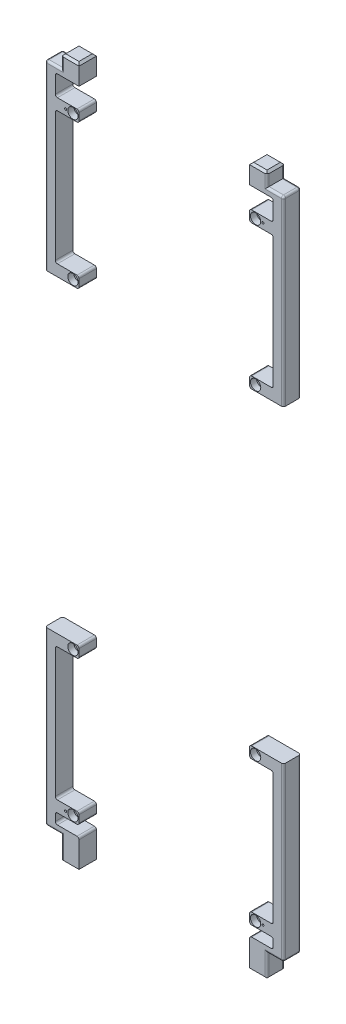
from build123d import *

# Parameters (mm, degrees)
FRAME_ALL_DEPTH                          = 2.6
F_1_5U_2U_3U_CUTOUT_DEPTH                = 2.6
SKETCH1_9_W                              = 41.5
SKETCH1_9_H                              = 5
BOTTOM_CROSS_PIECE_ALL_DEPTH             = 2.6
SKETCH1_6_W                              = 41.5
SKETCH1_6_H                              = 5
SKETCH1_6_H_2                            = 3
CROSS_PIECES_ALL_DEPTH                   = 3
SKETCH1_7_W                              = 8.5
SKETCH1_7_H                              = 14.5
FRAME_THICKEN_ALL_DEPTH                  = 8.5
SKETCH1_12_W                             = 11.5
SKETCH1_12_H                             = 1.6
F_1_5U_2U_3U_CUTOUT_THICKEN_DEPTH        = 8.5
SKETCH1_13_W                             = 11.5
SKETCH1_13_H                             = 5.5
F_2U_3U_TABS_DEPTH                       = 8.5
SKETCH1_14_W                             = 11.5
SKETCH1_14_H                             = 5.5
F_3U_TABS_DEPTH                          = 8.5
F_2U_3U_X_SCREW_PILLARS_AT_2_COUNT       = 2
F_2U_3U_X_SCREW_PILLARS_AT_2_PITCH       = 225.9
F_2U_3U_X_SCREW_PILLARS_AT_3_COUNT       = 2
F_2U_3U_X_SCREW_PILLARS_AT_3_PITCH       = 70
F_3U_X_SCREW_PILLARS_AT_2_COUNT          = 2
F_3U_X_SCREW_PILLARS_AT_2_PITCH          = 48.4
Y_HOLE_ALL_D                             = 1.5
END_CHAMFER_ALL_SIZE                     = 1
FILLET1_ALL_R                            = 2
FILLET2_ALL_R                            = 2
F_1_5U_2U_3U_SPINE_FILLET_R              = 1
F_2U_3U_TAB_FILLET_R                     = 1
F_3U_TAB_FILLET_R                        = 1
END_CHAMFER_ALL_OF_3U_MIRROR_SIZE        = 1
FILLET1_ALL_OF_3U_MIRROR_R               = 2
FILLET2_ALL_OF_3U_MIRROR_R               = 2
F_1_5U_2U_3U_SPINE_FILLET_OF_3U_MIRROR_R = 1
F_2U_3U_TAB_FILLET_OF_3U_MIRROR_R        = 1
F_3U_TAB_FILLET_OF_3U_MIRROR_R           = 1
F_3U_BAR_REMOVE_DEPTH                    = 337.150635876
F_3U_BAR_REMOVE_DEPTH_BACK               = 337.150635876
SKETCH32_W                               = 83
SKETCH32_H                               = 5.6
F_3U_SPLIT_DEPTH                         = 125
F_3U_SPLIT_DEPTH_BACK                    = 10
SKETCH27_W                               = 8.5
SKETCH27_H                               = 150.4


with BuildPart() as part:
    # Sketch1 → Frame(All) (new body)
    with BuildSketch(Plane.XY):
        Polygon((41.5, 322.5), (0, 322.5), (0, 319.5), (53, 319.5), (53, 309.45), (41.5, 309.45), (41.5, 303.95), (53, 303.95), (53, 11.95), (41.5, 11.95), (41.5, 8.05), (50, 8.05), (50, 8.95), (58, 8.95), (58, 322.5), (50, 322.5), (50, 329), (41.5, 329), align=None)
    frame_all = extrude(amount=-FRAME_ALL_DEPTH)

    # Sketch1<8> → 1.5U/2U/3U Cutout (add)
    with BuildSketch(Plane.XY):
        Polygon((58, 0), (58, 8.95), (50, 8.95), (50, 8.05), (53, 8.05), (53, 3), (50, 3), (50, 0), align=None)
    f_1_5u_2u_3u_cutout = extrude(amount=-F_1_5U_2U_3U_CUTOUT_DEPTH)

    # Sketch1<9> → Bottom Cross Piece (All) (add)
    with BuildSketch(Plane.XY):
        with Locations((20.75, -2.5)):
            Rectangle(SKETCH1_9_W, SKETCH1_9_H)
        Polygon((50, -11.5), (50, 0), (50, 3), (41.5, 3), (41.5, 0), (41.5, -5), (41.5, -11.5), align=None)
    bottom_cross_piece_all = extrude(amount=-BOTTOM_CROSS_PIECE_ALL_DEPTH)

    # Sketch1<6> → Cross Pieces (All) (add)
    with BuildSketch(Plane.XY):
        with Locations((20.75, -2.5)):
            Rectangle(SKETCH1_6_W, SKETCH1_6_H)
        with Locations((20.75, 321)):
            Rectangle(SKETCH1_6_W, SKETCH1_6_H_2)
    cross_pieces_all = extrude(amount=CROSS_PIECES_ALL_DEPTH)

    # Sketch1<7> → Frame Thicken (All) (add)
    with BuildSketch(Plane.XY):
        Polygon((41.5, 329), (41.5, 319.5), (53, 319.5), (53, 309.45), (41.5, 309.45), (41.5, 303.95), (53, 303.95), (53, 11.95), (41.5, 11.95), (41.5, 8.05), (50, 8.05), (50, 8.95), (58, 8.95), (58, 322.5), (50, 322.5), (50, 329), align=None)
        with Locations((45.75, -4.25)):
            Rectangle(SKETCH1_7_W, SKETCH1_7_H)
    frame_thicken_all = extrude(amount=-FRAME_THICKEN_ALL_DEPTH)

    # Sketch1<12> → 1.5U/2U/3U Cutout Thicken (add)
    with BuildSketch(Plane.XY):
        with Locations((47.25, 12.75)):
            Rectangle(SKETCH1_12_W, SKETCH1_12_H)
        Polygon((58, 0), (58, 8.95), (50, 8.95), (50, 8.05), (53, 8.05), (53, 3), (50, 3), (50, 0), align=None)
    f_1_5u_2u_3u_cutout_thicken = extrude(amount=-F_1_5U_2U_3U_CUTOUT_THICKEN_DEPTH)

    # Sketch1<13> → 2U/3U tabs (add)
    with BuildSketch(Plane.XY):
        with Locations((47.25, 236.7)):
            Rectangle(SKETCH1_13_W, SKETCH1_13_H)
        with Locations((47.25, 80.8)):
            Rectangle(SKETCH1_13_W, SKETCH1_13_H)
    f_2u_3u_tabs = extrude(amount=-F_2U_3U_TABS_DEPTH)

    # Sketch1<14> → 3U tabs (add)
    with BuildSketch(Plane.XY):
        with Locations((47.25, 182.95)):
            Rectangle(SKETCH1_14_W, SKETCH1_14_H)
        with Locations((47.25, 134.55)):
            Rectangle(SKETCH1_14_W, SKETCH1_14_H)
    f_3u_tabs = extrude(amount=-F_3U_TABS_DEPTH)

    # Sketch2 → X Top Screw Pillar (All) (revolve, cut)
    with BuildSketch(Plane(origin=(44.45, 306.7, 0), x_dir=(0, -1, 0), z_dir=(1, 0, 0))):
        Polygon((0, 0), (0, 10.871247898), (1.45, 10), (1.45, 3), (2.5, 3), (2.5, 0), align=None)
    x_top_screw_pillar_all = revolve(axis=Axis((44.45, 306.7, 6.35), (0, 0, -1)), mode=Mode.SUBTRACT)

    # Sketch6 → X Top Dowel Hole (All) (revolve, cut)
    with BuildSketch(Plane(origin=(48, 306.7, -8.5), x_dir=(0, 1, 0), z_dir=(1, 0, 0))):
        Polygon((0, 0), (0, 3.450645464), (0.75, 3), (0.75, 0), align=None)
    x_top_dowel_hole_all = revolve(axis=Axis((48, 306.7, -14.85), (0, 0, 1)), mode=Mode.SUBTRACT)

    # Sketch10 → X Top Dowel Hole Small (All) (revolve, cut)
    with BuildSketch(Plane(origin=(48, 306.7, -8.5), x_dir=(0, 1, 0), z_dir=(1, 0, 0))):
        Polygon((0, 0), (0, 8.80043031), (0.5, 8.5), (0.5, 0), align=None)
    x_top_dowel_hole_small_all = revolve(axis=Axis((48, 306.7, -14.85), (0, 0, 1)), mode=Mode.SUBTRACT)

    # Sketch13 → 2U/3U X Screw Pillars (revolve, cut)
    with BuildSketch(Plane(origin=(44.45, 10.8, 0), x_dir=(0, -1, 0), z_dir=(1, 0, 0))):
        Polygon((0, 0), (0, 9.401290929), (1.5, 8.5), (1.5, 2.9), (2.5, 2.9), (2.5, 0), align=None)
    f_2u_3u_x_screw_pillars = revolve(axis=Axis((44.45, 10.8, 6.35), (0, 0, -1)), mode=Mode.SUBTRACT)

    # 2U/3U X Screw Pillars at 2: 2U/3U X Screw Pillars ×2
    with Locations(*[(0, i * F_2U_3U_X_SCREW_PILLARS_AT_2_PITCH, 0) for i in range(1, F_2U_3U_X_SCREW_PILLARS_AT_2_COUNT)]):
        add(f_2u_3u_x_screw_pillars, mode=Mode.SUBTRACT)

    # 2U/3U X Screw Pillars at 3: 2U/3U X Screw Pillars ×2
    with Locations(*[(0, i * F_2U_3U_X_SCREW_PILLARS_AT_3_PITCH, 0) for i in range(1, F_2U_3U_X_SCREW_PILLARS_AT_3_COUNT)]):
        add(f_2u_3u_x_screw_pillars, mode=Mode.SUBTRACT)

    # Sketch14 → 3U X Screw Pillars (revolve, cut)
    with BuildSketch(Plane(origin=(44.45, 134.55, 0), x_dir=(0, -1, 0), z_dir=(1, 0, 0))):
        Polygon((0, 0), (0, 9.401290929), (1.5, 8.5), (1.5, 2.9), (2.5, 2.9), (2.5, 0), align=None)
    f_3u_x_screw_pillars = revolve(axis=Axis((44.45, 134.55, 6.35), (0, 0, -1)), mode=Mode.SUBTRACT)

    # 3U X Screw Pillars at 2: 3U X Screw Pillars ×2
    with Locations(*[(0, i * F_3U_X_SCREW_PILLARS_AT_2_PITCH, 0) for i in range(1, F_3U_X_SCREW_PILLARS_AT_2_COUNT)]):
        add(f_3u_x_screw_pillars, mode=Mode.SUBTRACT)

    # Sketch15 → 1.5U/2U/3U Dowel Hole (revolve, cut)
    with BuildSketch(Plane(origin=(48, 10.8, -8.5), x_dir=(0, 1, 0), z_dir=(1, 0, 0))):
        Polygon((0, 0), (0, 3.450645464), (0.75, 3), (0.75, 0), align=None)
    f_1_5u_2u_3u_dowel_hole = revolve(axis=Axis((48, 10.8, -14.85), (0, 0, 1)), mode=Mode.SUBTRACT)

    # Sketch16 → 1.5U/2U/3U Dowel Hole Small (revolve, cut)
    with BuildSketch(Plane(origin=(48, 10.8, -8.5), x_dir=(0, 1, 0), z_dir=(1, 0, 0))):
        Polygon((0, 0), (0, 8.80043031), (0.5, 8.5), (0.5, 0), align=None)
    f_1_5u_2u_3u_dowel_hole_small = revolve(axis=Axis((48, 10.8, -14.85), (0, 0, 1)), mode=Mode.SUBTRACT)

    # Y Hole (All) (through all)
    with Locations(Plane(origin=(27.5, -5, -0.5), x_dir=(-1, 0, 0), z_dir=(0, -1, 0))):
        with Locations((0, 0)):
            y_hole_all = Hole(Y_HOLE_ALL_D / 2)

    # End Chamfer (All)
    end_chamfer_all_edges = [part.edges().sort_by_distance(p)[0] for p in [
        (45.75, 329, -8.5),
        (45.75, -11.5, -8.5),
        (45.75, 329, 0),
        (41.5, 329, -4.25),
        (50, 329, -4.25),
        (45.75, -11.5, 0),
        (50, -11.5, -4.25),
        (41.5, -11.5, -4.25),
    ]]
    chamfer(end_chamfer_all_edges, length=END_CHAMFER_ALL_SIZE)

    # Fillet1 (All)
    fillet1_all_edges = [part.edges().sort_by_distance(p)[0] for p in [
        (41.5, -5, 1.5),
        (41.5, 322.5, 1.5),
    ]]
    fillet(fillet1_all_edges, radius=FILLET1_ALL_R)

    # Fillet2 (All)
    fillet2_all_edges = [part.edges().sort_by_distance(p)[0] for p in [
        (41.5, -5, -1.3),
        (41.5, 322.5, -1.3),
    ]]
    fillet(fillet2_all_edges, radius=FILLET2_ALL_R)

    # 1.5U/2U/3U Spine Fillet
    f_1_5u_2u_3u_spine_fillet_edges = [part.edges().sort_by_distance(p)[0] for p in [
        (54, 322.5, -8.5),
        (58, 161.25, -8.5),
        (50, -5.25, -8.5),
        (54, 0, -8.5),
        (54, 322.5, 0),
        (58, 161.25, 0),
        (58, 322.5, -4.25),
        (50, 325.25, -8.5),
        (50, 325.25, 0),
        (54, 0, 0),
        (58, 0, -4.25),
        (50, -5.25, 0),
    ]]
    fillet(f_1_5u_2u_3u_spine_fillet_edges, radius=F_1_5U_2U_3U_SPINE_FILLET_R)

    # 2U/3U Tab Fillet
    f_2u_3u_tab_fillet_edges = [part.edges().sort_by_distance(p)[0] for p in [
        (53, 13.55, -4.25),
        (41.5, 13.55, -4.25),
        (41.5, 233.95, -4.25),
        (41.5, 239.45, -4.25),
        (53, 239.45, -4.25),
        (41.5, 78.05, -4.25),
        (41.5, 83.55, -4.25),
        (53, 78.05, -4.25),
        (41.5, 303.95, -4.25),
        (41.5, 309.45, -4.25),
        (53, 309.45, -4.25),
        (53, 319.5, -4.25),
        (41.5, 8.05, -4.25),
        (53, 303.95, -4.25),
        (53, 3, -4.25),
        (53, 8.05, -4.25),
        (41.5, 3, -4.25),
    ]]
    fillet(f_2u_3u_tab_fillet_edges, radius=F_2U_3U_TAB_FILLET_R)

    # 3U Tab Fillet
    f_3u_tab_fillet_edges = [part.edges().sort_by_distance(p)[0] for p in [
        (41.5, 180.2, -4.25),
        (41.5, 185.7, -4.25),
        (53, 185.7, -4.25),
        (53, 180.2, -4.25),
        (41.5, 131.8, -4.25),
        (41.5, 137.3, -4.25),
        (53, 137.3, -4.25),
        (53, 131.8, -4.25),
    ]]
    fillet(f_3u_tab_fillet_edges, radius=F_3U_TAB_FILLET_R)

    # 3U Mirror: Frame(All), 1.5U/2U/3U Cutout, Bottom Cross Piece (All), Cross Pieces (All), Frame Thicken (All), 1.5U/2U/3U Cutout Thicken, 2U/3U tabs, 3U tabs, X Top Screw Pillar (All), X Top Dowel Hole (All), X Top Dowel Hole Small (All), 2U/3U X Screw Pillars, 3U X Screw Pillars, 1.5U/2U/3U Dowel Hole, 1.5U/2U/3U Dowel Hole Small, Y Hole (All) across plane
    add(frame_all.mirror(Plane(origin=(0, 0, -2.6), x_dir=(0, 0, 1), z_dir=(1, 0, 0))))
    add(f_1_5u_2u_3u_cutout.mirror(Plane(origin=(0, 0, -2.6), x_dir=(0, 0, 1), z_dir=(1, 0, 0))))
    add(bottom_cross_piece_all.mirror(Plane(origin=(0, 0, -2.6), x_dir=(0, 0, 1), z_dir=(1, 0, 0))))
    add(cross_pieces_all.mirror(Plane(origin=(0, 0, -2.6), x_dir=(0, 0, 1), z_dir=(1, 0, 0))))
    add(frame_thicken_all.mirror(Plane(origin=(0, 0, -2.6), x_dir=(0, 0, 1), z_dir=(1, 0, 0))))
    add(f_1_5u_2u_3u_cutout_thicken.mirror(Plane(origin=(0, 0, -2.6), x_dir=(0, 0, 1), z_dir=(1, 0, 0))))
    add(f_2u_3u_tabs.mirror(Plane(origin=(0, 0, -2.6), x_dir=(0, 0, 1), z_dir=(1, 0, 0))))
    add(f_3u_tabs.mirror(Plane(origin=(0, 0, -2.6), x_dir=(0, 0, 1), z_dir=(1, 0, 0))))
    add(x_top_screw_pillar_all.mirror(Plane(origin=(0, 0, -2.6), x_dir=(0, 0, 1), z_dir=(1, 0, 0))), mode=Mode.SUBTRACT)
    add(x_top_dowel_hole_all.mirror(Plane(origin=(0, 0, -2.6), x_dir=(0, 0, 1), z_dir=(1, 0, 0))), mode=Mode.SUBTRACT)
    add(x_top_dowel_hole_small_all.mirror(Plane(origin=(0, 0, -2.6), x_dir=(0, 0, 1), z_dir=(1, 0, 0))), mode=Mode.SUBTRACT)
    add(f_2u_3u_x_screw_pillars.mirror(Plane(origin=(0, 0, -2.6), x_dir=(0, 0, 1), z_dir=(1, 0, 0))), mode=Mode.SUBTRACT)
    add(f_3u_x_screw_pillars.mirror(Plane(origin=(0, 0, -2.6), x_dir=(0, 0, 1), z_dir=(1, 0, 0))), mode=Mode.SUBTRACT)
    add(f_1_5u_2u_3u_dowel_hole.mirror(Plane(origin=(0, 0, -2.6), x_dir=(0, 0, 1), z_dir=(1, 0, 0))), mode=Mode.SUBTRACT)
    add(f_1_5u_2u_3u_dowel_hole_small.mirror(Plane(origin=(0, 0, -2.6), x_dir=(0, 0, 1), z_dir=(1, 0, 0))), mode=Mode.SUBTRACT)
    add(y_hole_all.mirror(Plane(origin=(0, 0, -2.6), x_dir=(0, 0, 1), z_dir=(1, 0, 0))), mode=Mode.SUBTRACT)

    # 3U Mirror copy 1 sketch → 3U Mirror copy 1 (revolve, cut)
    with BuildSketch(Plane(origin=(-44.45, 236.7, 0), x_dir=(0, -1, 0), z_dir=(-1, 0, 0))):
        Polygon((0, 0), (0, -9.401290929), (1.5, -8.5), (1.5, -2.9), (2.5, -2.9), (2.5, 0), align=None)
    revolve(axis=Axis((-44.45, 236.7, 6.35), (0, 0, 1)), mode=Mode.SUBTRACT)

    # 3U Mirror copy 2 sketch → 3U Mirror copy 2 (revolve, cut)
    with BuildSketch(Plane(origin=(-44.45, 80.8, 0), x_dir=(0, -1, 0), z_dir=(-1, 0, 0))):
        Polygon((0, 0), (0, -9.401290929), (1.5, -8.5), (1.5, -2.9), (2.5, -2.9), (2.5, 0), align=None)
    revolve(axis=Axis((-44.45, 80.8, 6.35), (0, 0, 1)), mode=Mode.SUBTRACT)

    # 3U Mirror copy 3 sketch → 3U Mirror copy 3 (revolve, cut)
    with BuildSketch(Plane(origin=(-44.45, 182.95, 0), x_dir=(0, -1, 0), z_dir=(-1, 0, 0))):
        Polygon((0, 0), (0, -9.401290929), (1.5, -8.5), (1.5, -2.9), (2.5, -2.9), (2.5, 0), align=None)
    revolve(axis=Axis((-44.45, 182.95, 6.35), (0, 0, 1)), mode=Mode.SUBTRACT)

    # End Chamfer (All) of 3U Mirror
    end_chamfer_all_of_3u_mirror_edges = [part.edges().sort_by_distance(p)[0] for p in [
        (-45.75, 329, -8.5),
        (-45.75, -11.5, -8.5),
        (-45.75, 329, 0),
        (-41.5, 329, -4.25),
        (-50, 329, -4.25),
        (-45.75, -11.5, 0),
        (-50, -11.5, -4.25),
        (-41.5, -11.5, -4.25),
    ]]
    chamfer(end_chamfer_all_of_3u_mirror_edges, length=END_CHAMFER_ALL_OF_3U_MIRROR_SIZE)

    # Fillet1 (All) of 3U Mirror
    fillet1_all_of_3u_mirror_edges = [part.edges().sort_by_distance(p)[0] for p in [
        (-41.5, -5, 1.5),
        (-41.5, 322.5, 1.5),
    ]]
    fillet(fillet1_all_of_3u_mirror_edges, radius=FILLET1_ALL_OF_3U_MIRROR_R)

    # Fillet2 (All) of 3U Mirror
    fillet2_all_of_3u_mirror_edges = [part.edges().sort_by_distance(p)[0] for p in [
        (-41.5, -5, -1.3),
        (-41.5, 322.5, -1.3),
    ]]
    fillet(fillet2_all_of_3u_mirror_edges, radius=FILLET2_ALL_OF_3U_MIRROR_R)

    # 1.5U/2U/3U Spine Fillet of 3U Mirror
    f_1_5u_2u_3u_spine_fillet_of_3u_mirror_edges = [part.edges().sort_by_distance(p)[0] for p in [
        (-54, 322.5, -8.5),
        (-58, 161.25, -8.5),
        (-50, -5.25, -8.5),
        (-54, 0, -8.5),
        (-54, 322.5, 0),
        (-58, 161.25, 0),
        (-58, 322.5, -4.25),
        (-50, 325.25, -8.5),
        (-50, 325.25, 0),
        (-54, 0, 0),
        (-58, 0, -4.25),
        (-50, -5.25, 0),
    ]]
    fillet(f_1_5u_2u_3u_spine_fillet_of_3u_mirror_edges, radius=F_1_5U_2U_3U_SPINE_FILLET_OF_3U_MIRROR_R)

    # 2U/3U Tab Fillet of 3U Mirror
    f_2u_3u_tab_fillet_of_3u_mirror_edges = [part.edges().sort_by_distance(p)[0] for p in [
        (-53, 13.55, -4.25),
        (-41.5, 13.55, -4.25),
        (-41.5, 233.95, -4.25),
        (-41.5, 239.45, -4.25),
        (-53, 239.45, -4.25),
        (-41.5, 78.05, -4.25),
        (-41.5, 83.55, -4.25),
        (-53, 78.05, -4.25),
        (-41.5, 303.95, -4.25),
        (-41.5, 309.45, -4.25),
        (-53, 309.45, -4.25),
        (-53, 319.5, -4.25),
        (-41.5, 8.05, -4.25),
        (-53, 303.95, -4.25),
        (-53, 3, -4.25),
        (-53, 8.05, -4.25),
        (-41.5, 3, -4.25),
    ]]
    fillet(f_2u_3u_tab_fillet_of_3u_mirror_edges, radius=F_2U_3U_TAB_FILLET_OF_3U_MIRROR_R)

    # 3U Tab Fillet of 3U Mirror
    f_3u_tab_fillet_of_3u_mirror_edges = [part.edges().sort_by_distance(p)[0] for p in [
        (-41.5, 180.2, -4.25),
        (-41.5, 185.7, -4.25),
        (-53, 185.7, -4.25),
        (-53, 180.2, -4.25),
        (-41.5, 131.8, -4.25),
        (-41.5, 137.3, -4.25),
        (-53, 137.3, -4.25),
        (-53, 131.8, -4.25),
    ]]
    fillet(f_3u_tab_fillet_of_3u_mirror_edges, radius=F_3U_TAB_FILLET_OF_3U_MIRROR_R)

    # Sketch32 → 3U Bar Remove (cut, two sides: drawn at the far end of the back side and taken through both)
    with BuildSketch(Plane.XZ.offset(-319.5).offset(-F_3U_BAR_REMOVE_DEPTH_BACK)):
        with Locations((0, 0.2)):
            Rectangle(SKETCH32_W, SKETCH32_H)
    extrude(amount=F_3U_BAR_REMOVE_DEPTH + F_3U_BAR_REMOVE_DEPTH_BACK, mode=Mode.SUBTRACT)


with BuildPart() as f_3u_bar_remove_piece_1:
    # of the separate pieces the step leaves, piece 1, a body of its own (f_3u_bar_remove_pieces)
    add(part.part.solids().sort_by_distance((-53, 186.7, 0))[0])


with BuildPart() as f_3u_bar_remove_piece_2:
    # of the separate pieces the step leaves, piece 2, a body of its own (f_3u_bar_remove_pieces)
    add(part.part.solids().sort_by_distance((41.5, 319.5, 0))[0])


with BuildPart() as f_3u_split_tool:
    # Sketch27 → 3U split (new, two sides: drawn at the far end of the back side and taken through both)
    with BuildSketch(Plane.ZY.offset(-53).offset(-F_3U_SPLIT_DEPTH_BACK)):
        with Locations((-4.25, 158.75)):
            Rectangle(SKETCH27_W, SKETCH27_H)
    extrude(amount=F_3U_SPLIT_DEPTH + F_3U_SPLIT_DEPTH_BACK)


with BuildPart() as f_3u_bar_remove_piece_1_1:
    add(f_3u_bar_remove_piece_1.part)

    # 3U split: cut by f_3u_split_tool
    add(f_3u_split_tool.part, mode=Mode.SUBTRACT)


with BuildPart() as f_3u_bar_remove_piece_2_1:
    add(f_3u_bar_remove_piece_2.part)

    # 3U split: cut by f_3u_split_tool
    add(f_3u_split_tool.part, mode=Mode.SUBTRACT)


with BuildPart() as f_3u_split_piece_1:
    # of the separate pieces the step leaves, piece 1, a body of its own (f_3u_split_pieces)
    add(f_3u_bar_remove_piece_1_1.part.solids().sort_by_distance((-57, 83.55, 0))[0])


with BuildPart() as f_3u_split_piece_2:
    # of the separate pieces the step leaves, piece 2, a body of its own (f_3u_split_pieces)
    add(f_3u_bar_remove_piece_1_1.part.solids().sort_by_distance((-41.5, 234.95, 0))[0])


with BuildPart() as f_3u_split_piece_1_of_3u_bar_remove_piece:
    # of the separate pieces the step leaves, piece 1, a body of its own (f_3u_split_pieces_of_3u_bar_remove_piece_2)
    add(f_3u_bar_remove_piece_2_1.part.solids().sort_by_distance((57, 83.55, -8.5))[0])


with BuildPart() as f_3u_split_piece_2_of_3u_bar_remove_piece:
    # of the separate pieces the step leaves, piece 2, a body of its own (f_3u_split_pieces_of_3u_bar_remove_piece_2)
    add(f_3u_bar_remove_piece_2_1.part.solids().sort_by_distance((41.5, 319.5, 0))[0])


solid = Compound([f_3u_split_piece_1.part, f_3u_split_piece_2.part, f_3u_split_piece_1_of_3u_bar_remove_piece.part, f_3u_split_piece_2_of_3u_bar_remove_piece.part])
